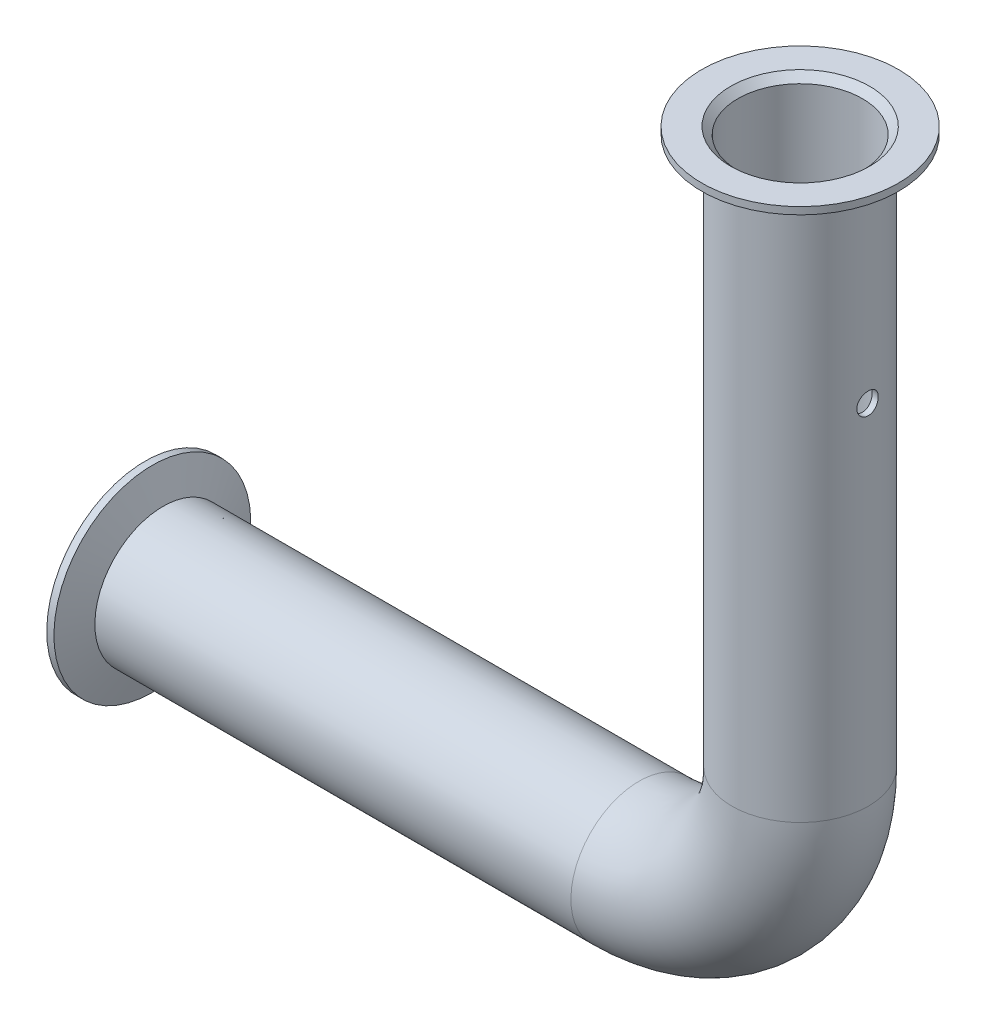
from build123d import *

# Parameters (mm, degrees)
SKETCH_2_R               = 19.05
SKETCH_2_R_2             = 17.4
SKETCH_2_2_R             = 19.05
SKETCH_2_2_R_2           = 17.4
CUT_EXTRUDE_1_REACH      = 293.662
SKETCH_6_R               = 17.4
CUT_EXTRUDE_2_REACH      = 309.803
SKETCH_7_R               = 17.4
CHAMFER_1_SIZE           = 2
CUT_EXTRUDE_3_DEPTH      = 289.073775273
CUT_EXTRUDE_3_DEPTH_BACK = 289.073775273
SKETCH_8_R               = 3


with BuildPart() as part:
    # 스윕1: sweep along a path in 스케치1
    with BuildLine(Plane.XY) as sweep_1_path:
        Line((0, 0), (133, 0))
        ThreePointArc((133, 0), (164.819805153, 13.180194847), (178, 45))
        Line((178, 45), (178, 195))
    # 스케치2 → 스윕1 (sweep)
    with BuildSketch(Plane(origin=(0, 0, 0), x_dir=(0, 0, -1), z_dir=(1, 0, 0))):
        Circle(SKETCH_2_R)
        Circle(SKETCH_2_R_2, mode=Mode.SUBTRACT)
    sweep(path=sweep_1_path.line)



with BuildPart() as body_2:
    # 스윕2: sweep along a path in 스케치1<2>
    with BuildLine(Plane.XY) as sweep_2_path:
        Line((0, 0), (133, 0))
        ThreePointArc((133, 0), (164.819805153, 13.180194847), (178, 45))
        Line((178, 45), (178, 195))
    # 스케치2<2> → 스윕2 (sweep)
    with BuildSketch(Plane(origin=(0, 0, 0), x_dir=(0, 0, -1), z_dir=(1, 0, 0))):
        Circle(SKETCH_2_2_R)
        Circle(SKETCH_2_2_R_2, mode=Mode.SUBTRACT)
    sweep(path=sweep_2_path.line)


with BuildPart() as part_1:
    add(part.part)

    add(body_2.part)  # 회전1 merges body 2
    # 스케치4 → 회전1 (revolve)
    with BuildSketch(Plane.XY, mode=Mode.PRIVATE) as revolve_1_sk:
        Polygon((0, 0), (0, 19.05), (-3, 27.5), (-5, 27.5), (-5, 0), align=None)
    revolve(revolve_1_sk.sketch.rotate(Axis((-5, 0, 0), (1, 0, 0)), 180), axis=Axis((-5, 0, 0), (1, 0, 0)))

    # 스케치5 → 회전2 (revolve)
    with BuildSketch(Plane.XY):
        Polygon((178, 195), (178, 200), (205.5, 200), (205.5, 198), (197.05, 195), align=None)
    revolve(axis=Axis((178, 195, 0), (0, 1, 0)))

    # 스케치6 → 컷-돌출1 (cut, up to next)
    with BuildSketch(Plane.ZY.offset(5), mode=Mode.PRIVATE) as cut_extrude_1_sk1:
        with Locations(Location((0, 0, 0), (0, 0, 270))):
            Circle(SKETCH_6_R)
    cut_extrude_1_tool1 = extrude(cut_extrude_1_sk1.sketch, amount=-CUT_EXTRUDE_1_REACH, mode=Mode.PRIVATE) & part_1.part
    add(cut_extrude_1_tool1.solids().sort_by_distance((-5, 0, 0))[0], mode=Mode.SUBTRACT)

    # 스케치7 → 컷-돌출2 (cut, up to next)
    with BuildSketch(Plane(origin=(0, 200, 0), x_dir=(1, 0, 0), z_dir=(0, 1, 0)), mode=Mode.PRIVATE) as cut_extrude_2_sk1:
        with Locations(Location((178, 0, 0), (0, 0, 270))):
            Circle(SKETCH_7_R)
    cut_extrude_2_tool1 = extrude(cut_extrude_2_sk1.sketch, amount=-CUT_EXTRUDE_2_REACH, mode=Mode.PRIVATE) & part_1.part
    add(cut_extrude_2_tool1.solids().sort_by_distance((178, 200, 0))[0], mode=Mode.SUBTRACT)

    # 모따기1
    chamfer_1_edges = [part_1.edges().sort_by_distance(p)[0] for p in [
        (-5, 17.4, 0),
        (178, 200, -17.4),
    ]]
    chamfer(chamfer_1_edges, length=CHAMFER_1_SIZE)

    # 스케치8 → 컷-돌출3 (cut, two sides: drawn at the far end of the back side and taken through both)
    with BuildSketch(Plane(origin=(0, 0, 0), x_dir=(0, 0, -1), z_dir=(1, 0, 0)).offset(-CUT_EXTRUDE_3_DEPTH_BACK)):
        with Locations((0, 142.5)):
            Circle(SKETCH_8_R)
    extrude(amount=CUT_EXTRUDE_3_DEPTH + CUT_EXTRUDE_3_DEPTH_BACK, mode=Mode.SUBTRACT)


solid = part_1.part
